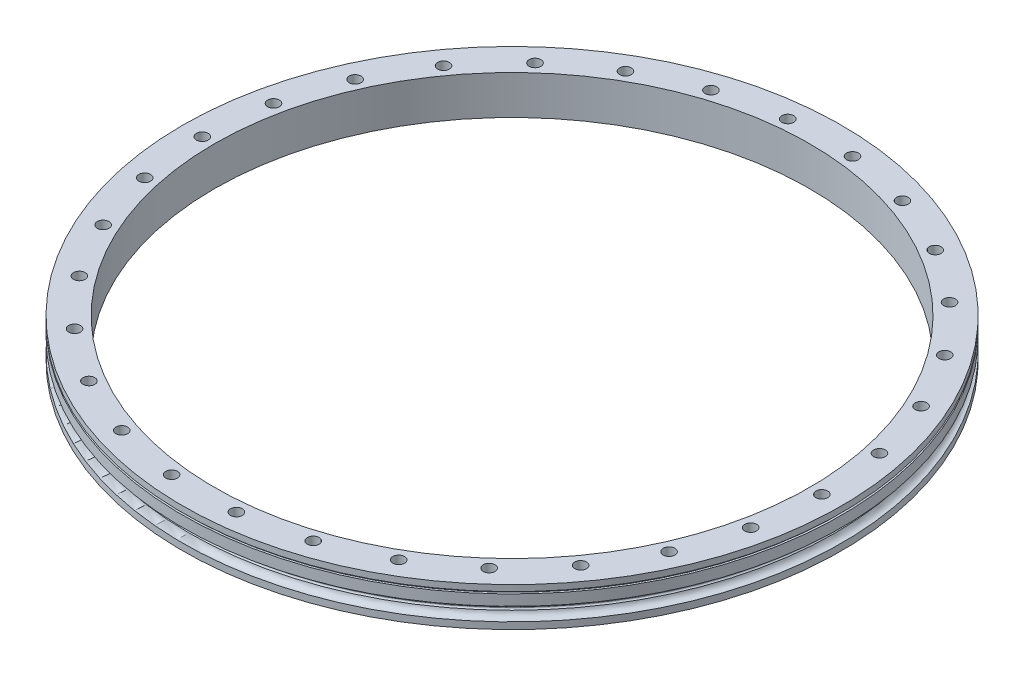
from build123d import *

# Parameters (mm, degrees)
ESQUISSE4_R                  = 8.75
ENL_V_MAT_EXTRU_2_DEPTH      = 697.092307097
R_P_TITION_CIRCULAIRE1_COUNT = 30


with BuildPart() as part:
    # Esquisse1 → Révolution1 (revolve)
    with BuildSketch(Plane.XY):
        with BuildLine():
            Line((-490.5, 58), (-490.5, 49))
            Line((-490.5, 49), (-487.5, 49))
            Line((-487.5, 49), (-487.5, 46))
            Line((-487.5, 46), (-490.5, 46))
            Line((-490.5, 46), (-490.5, 30))
            ThreePointArc((-490.5, 30), (-484.166348189, 27.738530528), (-480.697368421, 21.976970948))
            ThreePointArc((-480.697368421, 21.976970948), (-479, 20), (-480.697368421, 18.023029052))
            ThreePointArc((-480.697368421, 18.023029052), (-484.166348189, 12.261469472), (-490.5, 10))
            Line((-490.5, 10), (-490.5, 0))
            Line((-490.5, 0), (-443, 0))
            Line((-443, 0), (-443, 58))
            Line((-443, 58), (-490.5, 58))
        make_face()
    revolve(axis=Axis((0, 58, 0), (0, -1, 0)))

    # Esquisse4 → Enlèv. mat.-Extru.2 (cut, through all)
    with BuildSketch(Plane(origin=(0, 58, 0), x_dir=(1, 0, 0), z_dir=(0, 1, 0))):
        with Locations((-461, 0)):
            Circle(ESQUISSE4_R)
    enl_v_mat_extru_2 = extrude(amount=-ENL_V_MAT_EXTRU_2_DEPTH, mode=Mode.SUBTRACT)

    # Répétition circulaire1: Enlèv. mat.-Extru.2 ×30 about axis
    r_p_tition_circulaire1_axis = Axis((0, 45.15, 0), (0, -1, 0))
    for i in range(1, R_P_TITION_CIRCULAIRE1_COUNT):
        add(enl_v_mat_extru_2.rotate(r_p_tition_circulaire1_axis, i * 360 / R_P_TITION_CIRCULAIRE1_COUNT), mode=Mode.SUBTRACT)


solid = part.part
